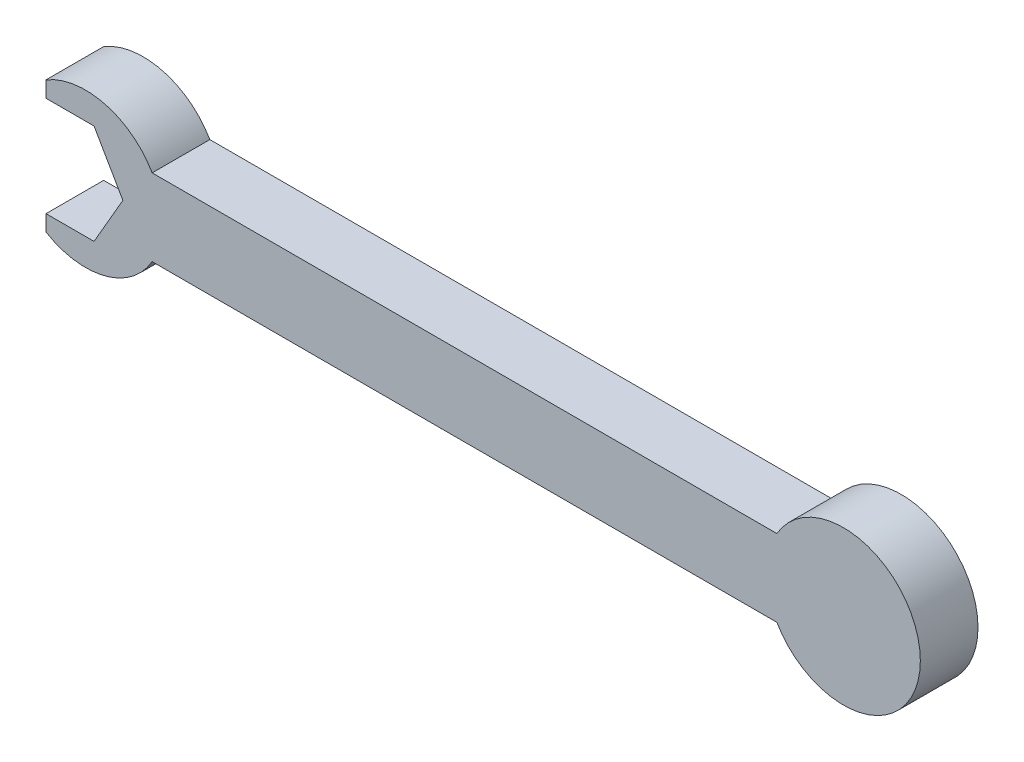
from build123d import *

# Parameters (mm, degrees)
BOSS_EXTRUDE1_DEPTH     = 3.81
CUT_EXTRUDE1_DEPTH      = 111.840048291
CUT_EXTRUDE1_DEPTH_BACK = 111.840048291


with BuildPart() as part:
    # Sketch1 → Boss-Extrude1 (new, symmetric)
    with BuildSketch(Plane.XY):
        with BuildLine():
            ThreePointArc((10.16, 0), (9.813806395, 2.629601498), (8.798818102, 5.08))
            Line((8.798818102, 5.08), (8.798818102, -5.08))
            ThreePointArc((8.798818102, -5.08), (9.813806395, -2.629601498), (10.16, 0))
        make_face()
        with BuildLine():
            Line((8.798818102, -5.08), (8.798818102, 5.08))
            ThreePointArc((8.798818102, 5.08), (-10.16, 0), (8.798818102, -5.08))
        make_face()
        with BuildLine():
            Line((91.348818102, 5.08), (8.798818102, 5.08))
            ThreePointArc((8.798818102, 5.08), (9.813806395, 2.629601498), (10.16, 0))
            ThreePointArc((10.16, 0), (9.813806395, -2.629601498), (8.798818102, -5.08))
            Line((8.798818102, -5.08), (91.348818102, -5.08))
            ThreePointArc((91.348818102, -5.08), (89.987636205, 0), (91.348818102, 5.08))
        make_face()
        with BuildLine():
            ThreePointArc((110.307636205, 0), (102.777237703, 9.813806395), (91.348818102, 5.08))
            Line((91.348818102, 5.08), (91.348818102, -5.08))
            ThreePointArc((91.348818102, -5.08), (102.777237703, -9.813806395), (110.307636205, 0))
        make_face()
        with BuildLine():
            Line((91.348818102, -5.08), (91.348818102, 5.08))
            ThreePointArc((91.348818102, 5.08), (89.987636205, 0), (91.348818102, -5.08))
        make_face()
        with BuildLine():
            ThreePointArc((110.307636205, 0), (102.777237703, 9.813806395), (91.348818102, 5.08))
            Line((91.348818102, 5.08), (91.348818102, -5.08))
            ThreePointArc((91.348818102, -5.08), (102.777237703, -9.813806395), (110.307636205, 0))
        make_face()
        with BuildLine():
            Line((91.348818102, -5.08), (91.348818102, 5.08))
            ThreePointArc((91.348818102, 5.08), (89.987636205, 0), (91.348818102, -5.08))
        make_face()
        with BuildLine():
            ThreePointArc((10.16, 0), (9.813806395, 2.629601498), (8.798818102, 5.08))
            Line((8.798818102, 5.08), (8.798818102, -5.08))
            ThreePointArc((8.798818102, -5.08), (9.813806395, -2.629601498), (10.16, 0))
        make_face()
        with BuildLine():
            Line((8.798818102, -5.08), (8.798818102, 5.08))
            ThreePointArc((8.798818102, 5.08), (-10.16, 0), (8.798818102, -5.08))
        make_face()
    extrude(amount=BOSS_EXTRUDE1_DEPTH, both=True)

    # Sketch2 → Cut-Extrude1 (cut, two sides: drawn at the far end of the back side and taken through both)
    with BuildSketch(Plane.XY.offset(-CUT_EXTRUDE1_DEPTH_BACK)):
        Polygon((1.118947019, 6.599113577), (-5.231052981, 6.599113577), (-5.231052981, -6.599113577), (1.118947019, -6.599113577), (4.928947019, 0), align=None)
        with BuildLine():
            Line((-5.231052981, -6.599113577), (-5.231052981, 6.599113577))
            Line((-5.231052981, 6.599113577), (-6.501052981, 6.599113577))
            Line((-6.501052981, 6.599113577), (-10.156471519, 0.267742946))
            ThreePointArc((-10.156471519, 0.267742946), (-10.16, 0), (-10.156471519, -0.267742946))
            Line((-10.156471519, -0.267742946), (-6.501052981, -6.599113577))
            Line((-6.501052981, -6.599113577), (-5.231052981, -6.599113577))
        make_face()
        with BuildLine():
            Line((-5.231052981, 6.599113577), (-5.231052981, 8.709861349))
            ThreePointArc((-5.231052981, 8.709861349), (-8.775609286, 5.119988443), (-10.156471519, 0.267742946))
            Line((-10.156471519, 0.267742946), (-6.501052981, 6.599113577))
            Line((-6.501052981, 6.599113577), (-5.231052981, 6.599113577))
        make_face()
        with BuildLine():
            Line((-5.231052981, -8.709861349), (-5.231052981, -6.599113577))
            Line((-5.231052981, -6.599113577), (-6.501052981, -6.599113577))
            Line((-6.501052981, -6.599113577), (-10.156471519, -0.267742946))
            ThreePointArc((-10.156471519, -0.267742946), (-8.775609286, -5.119988443), (-5.231052981, -8.709861349))
        make_face()
    extrude(amount=CUT_EXTRUDE1_DEPTH + CUT_EXTRUDE1_DEPTH_BACK, mode=Mode.SUBTRACT)


solid = part.part
